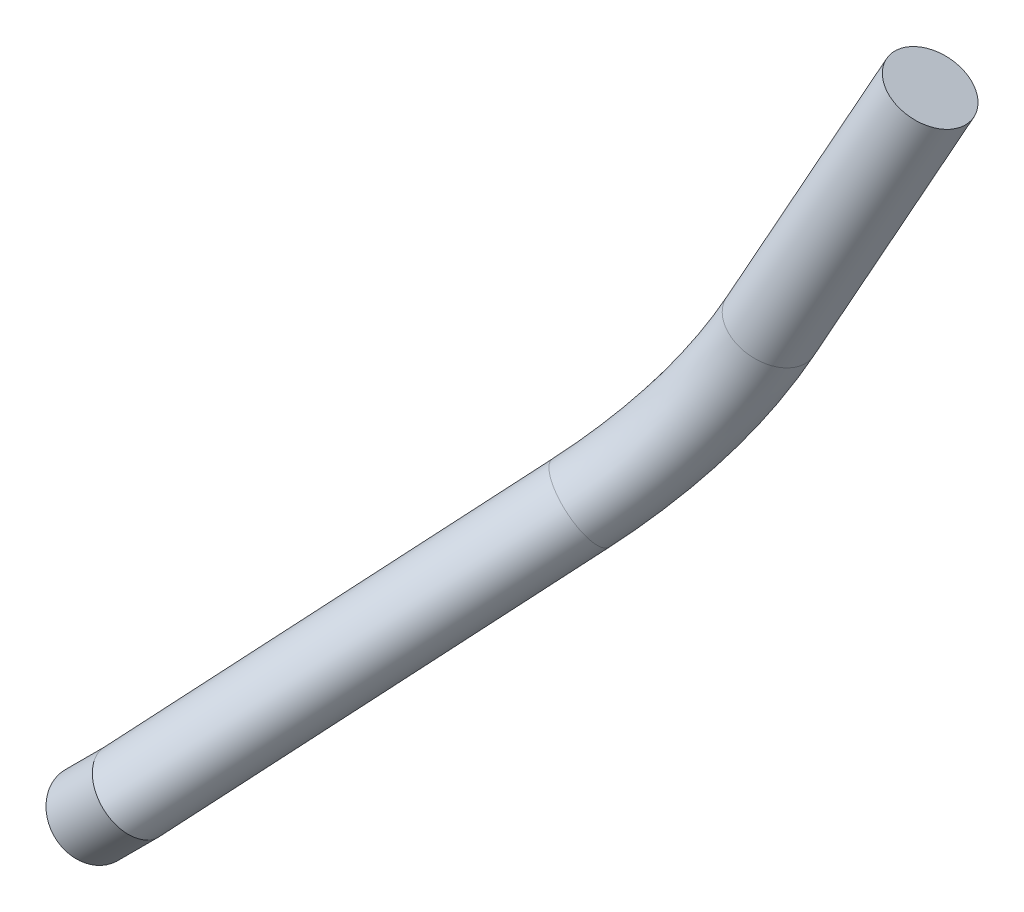
from build123d import *

# Parameters (mm, degrees)
SWEEP1_PROFILE_R = 4.699


with BuildPart() as part:
    # Sweep1: sweep along a curve in space
    with BuildLine() as sweep1_path:
        Line((238.754370819, 134.269695833, 168.702443465), (253.620262853, 165.140017683, 163.321796801))
        ThreePointArc((225.215214035, 113.368458468, 179.112833538), (232.362452735, 122.832817986, 172.418661174), (238.754370819, 134.269695833, 168.702443465))
        Line((198.085125282, 82.991088831, 208.7608), (225.215214035, 113.368458468, 179.112833538))
        Line((198.085125282, 82.991088831, 208.7608), (193.010891229, 77.916854778, 208.7608))
    # Sweep1 profile (on start of the path) → Sweep1 (sweep)
    with BuildSketch(Plane(origin=(193.010891229, 77.916854778, 208.7608), x_dir=(-0.7071067811863416, 0.7071067811867535, 0), z_dir=(0.7071067811867535, 0.7071067811863416, 3.208113469401575e-13))):
        Circle(SWEEP1_PROFILE_R)
    sweep(path=sweep1_path.line, transition=Transition.RIGHT)


solid = part.part
